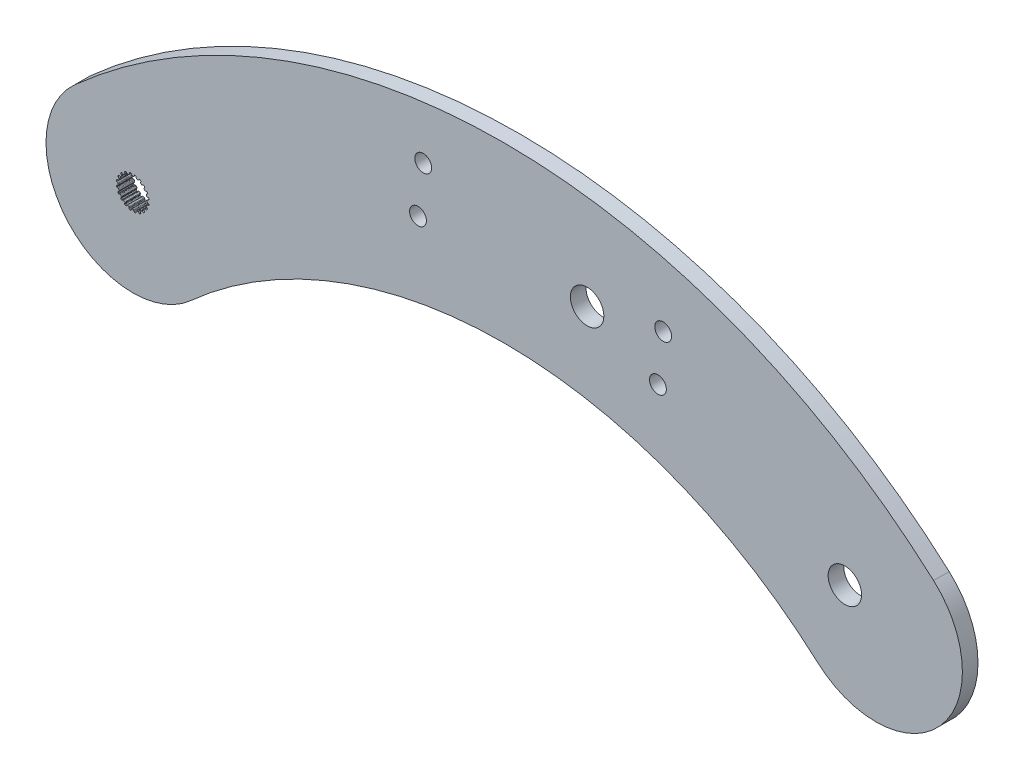
from build123d import *

# Parameters (mm, degrees)
BOSS_EXTRUDE1_DEPTH = 3.2004
SKETCH2_R           = 1.7272
SKETCH2_R_2         = 3.429
CUT_EXTRUDE1_DEPTH  = 3.2004


with BuildPart() as part:
    # Sketch1 → Boss-Extrude1 (new body)
    with BuildSketch(Plane.XY):
        with BuildLine():
            ThreePointArc((-11.875315661, 13.236894431), (76.2, 46.954576728), (164.275315661, 13.236894431))
            ThreePointArc((164.275315661, 13.236894431), (165.636894431, -11.875315661), (140.524684339, -13.236894431))
            ThreePointArc((140.524684339, -13.236894431), (76.2, 11.388385128), (11.875315661, -13.236894431))
            ThreePointArc((11.875315661, -13.236894431), (-13.236894431, -11.875315661), (-11.875315661, 13.236894431))
        make_face()
        with BuildLine():
            Line((-0.106949245, 2.969874934), (0.106949245, 2.969874934))
            ThreePointArc((0.106949245, 2.969874934), (0.196343213, 2.986924176), (0.253739238, 3.057547504))
            Line((0.253739238, 3.057547504), (0.315888147, 3.237526941))
            ThreePointArc((0.315888147, 3.237526941), (0.359032156, 3.298322911), (0.4281449, 3.326269005))
            Line((0.4281449, 3.326269005), (0.620027588, 3.2937547))
            ThreePointArc((0.620027588, 3.2937547), (0.689621142, 3.24802576), (0.718272212, 3.169836791))
            Line((0.718272212, 3.169836791), (0.724389167, 2.979527391))
            ThreePointArc((0.724389167, 2.979527391), (0.750934762, 2.9040661), (0.816027049, 2.857568043))
            Line((0.816027049, 2.857568043), (1.019456602, 2.791469774))
            ThreePointArc((1.019456602, 2.791469774), (1.109743823, 2.780060312), (1.186154496, 2.829490741))
            Line((1.186154496, 2.829490741), (1.300878326, 2.981456288))
            ThreePointArc((1.300878326, 2.981456288), (1.360697704, 3.02594446), (1.435063648, 3.031165762))
            Line((1.435063648, 3.031165762), (1.607507455, 2.940947809))
            ThreePointArc((1.607507455, 2.940947809), (1.659563839, 2.875951412), (1.662650905, 2.792735615))
            Line((1.662650905, 2.792735615), (1.609659636, 2.609850378))
            ThreePointArc((1.609659636, 2.609850378), (1.611587176, 2.529879385), (1.659124931, 2.465542482))
            Line((1.659124931, 2.465542482), (1.832172444, 2.339816104))
            ThreePointArc((1.832172444, 2.339816104), (1.914514976, 2.301064775), (2.002460687, 2.32446371))
            Line((2.002460687, 2.32446371), (2.158529469, 2.433539921))
            ThreePointArc((2.158529469, 2.433539921), (2.229168681, 2.457365482), (2.301508367, 2.439350895))
            Line((2.301508367, 2.439350895), (2.437633293, 2.300260456))
            ThreePointArc((2.437633293, 2.300260456), (2.467056864, 2.222358901), (2.444277744, 2.14226202))
            Line((2.444277744, 2.14226202), (2.337365406, 1.984703026))
            ThreePointArc((2.337365406, 1.984703026), (2.314486209, 1.908050449), (2.339816104, 1.832172444))
            Line((2.339816104, 1.832172444), (2.465542482, 1.659124931))
            ThreePointArc((2.465542482, 1.659124931), (2.531880064, 1.596824985), (2.622752074, 1.591901975))
            Line((2.622752074, 1.591901975), (2.804888709, 1.64741171))
            ThreePointArc((2.804888709, 1.64741171), (2.879433095, 1.648242449), (2.942665411, 1.608755366))
            Line((2.942665411, 1.608755366), (3.0291466, 1.434407582))
            ThreePointArc((3.0291466, 1.434407582), (3.033057175, 1.351226417), (2.986641646, 1.282088892))
            Line((2.986641646, 1.282088892), (2.836273564, 1.165279113))
            ThreePointArc((2.836273564, 1.165279113), (2.790827206, 1.099448241), (2.791469774, 1.019456602))
            Line((2.791469774, 1.019456602), (2.857568043, 0.816027049))
            ThreePointArc((2.857568043, 0.816027049), (2.901407091, 0.736276839), (2.986310214, 0.703513784))
            Line((2.986310214, 0.703513784), (3.1766859, 0.700023363))
            ThreePointArc((3.1766859, 0.700023363), (3.247838536, 0.677777961), (3.295773863, 0.620683653))
            Line((3.295773863, 0.620683653), (3.324145932, 0.4281449))
            ThreePointArc((3.324145932, 0.4281449), (3.302160717, 0.347826477), (3.236652255, 0.29641597))
            Line((3.236652255, 0.29641597), (3.057547504, 0.231789562))
            ThreePointArc((3.057547504, 0.231789562), (2.993982591, 0.183224379), (2.969874934, 0.106949245))
            Line((2.969874934, 0.106949245), (2.969874934, -0.106949245))
            ThreePointArc((2.969874934, -0.106949245), (2.986924176, -0.196343213), (3.057547504, -0.253739238))
            Line((3.057547504, -0.253739238), (3.237526941, -0.315888147))
            ThreePointArc((3.237526941, -0.315888147), (3.298322911, -0.359032156), (3.326269005, -0.4281449))
            Line((3.326269005, -0.4281449), (3.2937547, -0.620027588))
            ThreePointArc((3.2937547, -0.620027588), (3.24802576, -0.689621142), (3.169836791, -0.718272212))
            Line((3.169836791, -0.718272212), (2.979527391, -0.724389167))
            ThreePointArc((2.979527391, -0.724389167), (2.9040661, -0.750934762), (2.857568043, -0.816027049))
            Line((2.857568043, -0.816027049), (2.791469774, -1.019456602))
            ThreePointArc((2.791469774, -1.019456602), (2.780060312, -1.109743823), (2.829490741, -1.186154496))
            Line((2.829490741, -1.186154496), (2.981456288, -1.300878326))
            ThreePointArc((2.981456288, -1.300878326), (3.02594446, -1.360697704), (3.031165762, -1.435063648))
            Line((3.031165762, -1.435063648), (2.940947809, -1.607507455))
            ThreePointArc((2.940947809, -1.607507455), (2.875951412, -1.659563839), (2.792735615, -1.662650905))
            Line((2.792735615, -1.662650905), (2.609850378, -1.609659636))
            ThreePointArc((2.609850378, -1.609659636), (2.529879385, -1.611587176), (2.465542482, -1.659124931))
            Line((2.465542482, -1.659124931), (2.339816104, -1.832172444))
            ThreePointArc((2.339816104, -1.832172444), (2.301064775, -1.914514976), (2.32446371, -2.002460687))
            Line((2.32446371, -2.002460687), (2.433539921, -2.158529469))
            ThreePointArc((2.433539921, -2.158529469), (2.457365482, -2.229168681), (2.439350895, -2.301508367))
            Line((2.439350895, -2.301508367), (2.300260456, -2.437633293))
            ThreePointArc((2.300260456, -2.437633293), (2.222358901, -2.467056864), (2.14226202, -2.444277744))
            Line((2.14226202, -2.444277744), (1.984703026, -2.337365406))
            ThreePointArc((1.984703026, -2.337365406), (1.908050449, -2.314486209), (1.832172444, -2.339816104))
            Line((1.832172444, -2.339816104), (1.659124931, -2.465542482))
            ThreePointArc((1.659124931, -2.465542482), (1.596824985, -2.531880064), (1.591901975, -2.622752074))
            Line((1.591901975, -2.622752074), (1.64741171, -2.804888709))
            ThreePointArc((1.64741171, -2.804888709), (1.648242449, -2.879433095), (1.608755366, -2.942665411))
            Line((1.608755366, -2.942665411), (1.434407582, -3.0291466))
            ThreePointArc((1.434407582, -3.0291466), (1.351226417, -3.033057175), (1.282088892, -2.986641646))
            Line((1.282088892, -2.986641646), (1.165279113, -2.836273564))
            ThreePointArc((1.165279113, -2.836273564), (1.099448241, -2.790827206), (1.019456602, -2.791469774))
            Line((1.019456602, -2.791469774), (0.816027049, -2.857568043))
            ThreePointArc((0.816027049, -2.857568043), (0.736276839, -2.901407091), (0.703513784, -2.986310214))
            Line((0.703513784, -2.986310214), (0.700023363, -3.1766859))
            ThreePointArc((0.700023363, -3.1766859), (0.677777961, -3.247838536), (0.620683653, -3.295773863))
            Line((0.620683653, -3.295773863), (0.4281449, -3.324145932))
            ThreePointArc((0.4281449, -3.324145932), (0.347826477, -3.302160717), (0.29641597, -3.236652255))
            Line((0.29641597, -3.236652255), (0.231789562, -3.057547504))
            ThreePointArc((0.231789562, -3.057547504), (0.183224379, -2.993982591), (0.106949245, -2.969874934))
            Line((0.106949245, -2.969874934), (-0.106949245, -2.969874934))
            ThreePointArc((-0.106949245, -2.969874934), (-0.196343213, -2.986924176), (-0.253739238, -3.057547504))
            Line((-0.253739238, -3.057547504), (-0.315888147, -3.237526941))
            ThreePointArc((-0.315888147, -3.237526941), (-0.359032156, -3.298322911), (-0.4281449, -3.326269005))
            Line((-0.4281449, -3.326269005), (-0.620027588, -3.2937547))
            ThreePointArc((-0.620027588, -3.2937547), (-0.689621142, -3.24802576), (-0.718272212, -3.169836791))
            Line((-0.718272212, -3.169836791), (-0.724389167, -2.979527391))
            ThreePointArc((-0.724389167, -2.979527391), (-0.750934762, -2.9040661), (-0.816027049, -2.857568043))
            Line((-0.816027049, -2.857568043), (-1.019456602, -2.791469774))
            ThreePointArc((-1.019456602, -2.791469774), (-1.109743823, -2.780060312), (-1.186154496, -2.829490741))
            Line((-1.186154496, -2.829490741), (-1.300878326, -2.981456288))
            ThreePointArc((-1.300878326, -2.981456288), (-1.360697704, -3.02594446), (-1.435063648, -3.031165762))
            Line((-1.435063648, -3.031165762), (-1.607507455, -2.940947809))
            ThreePointArc((-1.607507455, -2.940947809), (-1.659563839, -2.875951412), (-1.662650905, -2.792735615))
            Line((-1.662650905, -2.792735615), (-1.609659636, -2.609850378))
            ThreePointArc((-1.609659636, -2.609850378), (-1.611587176, -2.529879385), (-1.659124931, -2.465542482))
            Line((-1.659124931, -2.465542482), (-1.832172444, -2.339816104))
            ThreePointArc((-1.832172444, -2.339816104), (-1.914514976, -2.301064775), (-2.002460687, -2.32446371))
            Line((-2.002460687, -2.32446371), (-2.158529469, -2.433539921))
            ThreePointArc((-2.158529469, -2.433539921), (-2.229168681, -2.457365482), (-2.301508367, -2.439350895))
            Line((-2.301508367, -2.439350895), (-2.437633293, -2.300260456))
            ThreePointArc((-2.437633293, -2.300260456), (-2.467056864, -2.222358901), (-2.444277744, -2.14226202))
            Line((-2.444277744, -2.14226202), (-2.337365406, -1.984703026))
            ThreePointArc((-2.337365406, -1.984703026), (-2.314486209, -1.908050449), (-2.339816104, -1.832172444))
            Line((-2.339816104, -1.832172444), (-2.465542482, -1.659124931))
            ThreePointArc((-2.465542482, -1.659124931), (-2.531880064, -1.596824985), (-2.622752074, -1.591901975))
            Line((-2.622752074, -1.591901975), (-2.804888709, -1.64741171))
            ThreePointArc((-2.804888709, -1.64741171), (-2.879433095, -1.648242449), (-2.942665411, -1.608755366))
            Line((-2.942665411, -1.608755366), (-3.0291466, -1.434407582))
            ThreePointArc((-3.0291466, -1.434407582), (-3.033057175, -1.351226417), (-2.986641646, -1.282088892))
            Line((-2.986641646, -1.282088892), (-2.836273564, -1.165279113))
            ThreePointArc((-2.836273564, -1.165279113), (-2.790827206, -1.099448241), (-2.791469774, -1.019456602))
            Line((-2.791469774, -1.019456602), (-2.857568043, -0.816027049))
            ThreePointArc((-2.857568043, -0.816027049), (-2.901407091, -0.736276839), (-2.986310214, -0.703513784))
            Line((-2.986310214, -0.703513784), (-3.1766859, -0.700023363))
            ThreePointArc((-3.1766859, -0.700023363), (-3.247838536, -0.677777961), (-3.295773863, -0.620683653))
            Line((-3.295773863, -0.620683653), (-3.324145932, -0.4281449))
            ThreePointArc((-3.324145932, -0.4281449), (-3.302160717, -0.347826477), (-3.236652255, -0.29641597))
            Line((-3.236652255, -0.29641597), (-3.057547504, -0.231789562))
            ThreePointArc((-3.057547504, -0.231789562), (-2.993982591, -0.183224379), (-2.969874934, -0.106949245))
            Line((-2.969874934, -0.106949245), (-2.969874934, 0.106949245))
            ThreePointArc((-2.969874934, 0.106949245), (-2.986924176, 0.196343213), (-3.057547504, 0.253739238))
            Line((-3.057547504, 0.253739238), (-3.237526941, 0.315888147))
            ThreePointArc((-3.237526941, 0.315888147), (-3.298322911, 0.359032156), (-3.326269005, 0.4281449))
            Line((-3.326269005, 0.4281449), (-3.2937547, 0.620027588))
            ThreePointArc((-3.2937547, 0.620027588), (-3.24802576, 0.689621142), (-3.169836791, 0.718272212))
            Line((-3.169836791, 0.718272212), (-2.979527391, 0.724389167))
            ThreePointArc((-2.979527391, 0.724389167), (-2.9040661, 0.750934762), (-2.857568043, 0.816027049))
            Line((-2.857568043, 0.816027049), (-2.791469774, 1.019456602))
            ThreePointArc((-2.791469774, 1.019456602), (-2.780060312, 1.109743823), (-2.829490741, 1.186154496))
            Line((-2.829490741, 1.186154496), (-2.981456288, 1.300878326))
            ThreePointArc((-2.981456288, 1.300878326), (-3.02594446, 1.360697704), (-3.031165762, 1.435063648))
            Line((-3.031165762, 1.435063648), (-2.940947809, 1.607507455))
            ThreePointArc((-2.940947809, 1.607507455), (-2.875951412, 1.659563839), (-2.792735615, 1.662650905))
            Line((-2.792735615, 1.662650905), (-2.609850378, 1.609659636))
            ThreePointArc((-2.609850378, 1.609659636), (-2.529879385, 1.611587176), (-2.465542482, 1.659124931))
            Line((-2.465542482, 1.659124931), (-2.339816104, 1.832172444))
            ThreePointArc((-2.339816104, 1.832172444), (-2.301064775, 1.914514976), (-2.32446371, 2.002460687))
            Line((-2.32446371, 2.002460687), (-2.433539921, 2.158529469))
            ThreePointArc((-2.433539921, 2.158529469), (-2.457365482, 2.229168681), (-2.439350895, 2.301508367))
            Line((-2.439350895, 2.301508367), (-2.300260456, 2.437633293))
            ThreePointArc((-2.300260456, 2.437633293), (-2.222358901, 2.467056864), (-2.14226202, 2.444277744))
            Line((-2.14226202, 2.444277744), (-1.984703026, 2.337365406))
            ThreePointArc((-1.984703026, 2.337365406), (-1.908050449, 2.314486209), (-1.832172444, 2.339816104))
            Line((-1.832172444, 2.339816104), (-1.659124931, 2.465542482))
            ThreePointArc((-1.659124931, 2.465542482), (-1.596824985, 2.531880064), (-1.591901975, 2.622752074))
            Line((-1.591901975, 2.622752074), (-1.64741171, 2.804888709))
            ThreePointArc((-1.64741171, 2.804888709), (-1.648242449, 2.879433095), (-1.608755366, 2.942665411))
            Line((-1.608755366, 2.942665411), (-1.434407582, 3.0291466))
            ThreePointArc((-1.434407582, 3.0291466), (-1.351226417, 3.033057175), (-1.282088892, 2.986641646))
            Line((-1.282088892, 2.986641646), (-1.165279113, 2.836273564))
            ThreePointArc((-1.165279113, 2.836273564), (-1.099448241, 2.790827206), (-1.019456602, 2.791469774))
            Line((-1.019456602, 2.791469774), (-0.816027049, 2.857568043))
            ThreePointArc((-0.816027049, 2.857568043), (-0.736276839, 2.901407091), (-0.703513784, 2.986310214))
            Line((-0.703513784, 2.986310214), (-0.700023363, 3.1766859))
            ThreePointArc((-0.700023363, 3.1766859), (-0.677777961, 3.247838536), (-0.620683653, 3.295773863))
            Line((-0.620683653, 3.295773863), (-0.4281449, 3.324145932))
            ThreePointArc((-0.4281449, 3.324145932), (-0.347826477, 3.302160717), (-0.29641597, 3.236652255))
            Line((-0.29641597, 3.236652255), (-0.231789562, 3.057547504))
            ThreePointArc((-0.231789562, 3.057547504), (-0.183224379, 2.993982591), (-0.106949245, 2.969874934))
        make_face(mode=Mode.SUBTRACT)
    extrude(amount=BOSS_EXTRUDE1_DEPTH)

    # Sketch2 → Cut-Extrude1 (cut)
    with BuildSketch(Plane.XY.offset(3.2004)):
        with Locations((59.593537924, 35.057555669)):
            Circle(SKETCH2_R)
        with Locations((107.731512527, 19.793696311)):
            Circle(SKETCH2_R)
        with Locations((108.806627871, 29.73573475)):
            Circle(SKETCH2_R)
        with Locations((58.51842258, 25.11551723)):
            Circle(SKETCH2_R)
        with Locations((93.206882064, 26.393515266)):
            Circle(SKETCH2_R_2)
        with Locations((146.072443398, 3.315240757)):
            Circle(SKETCH2_R_2)
    extrude(amount=-CUT_EXTRUDE1_DEPTH, mode=Mode.SUBTRACT)


solid = part.part
